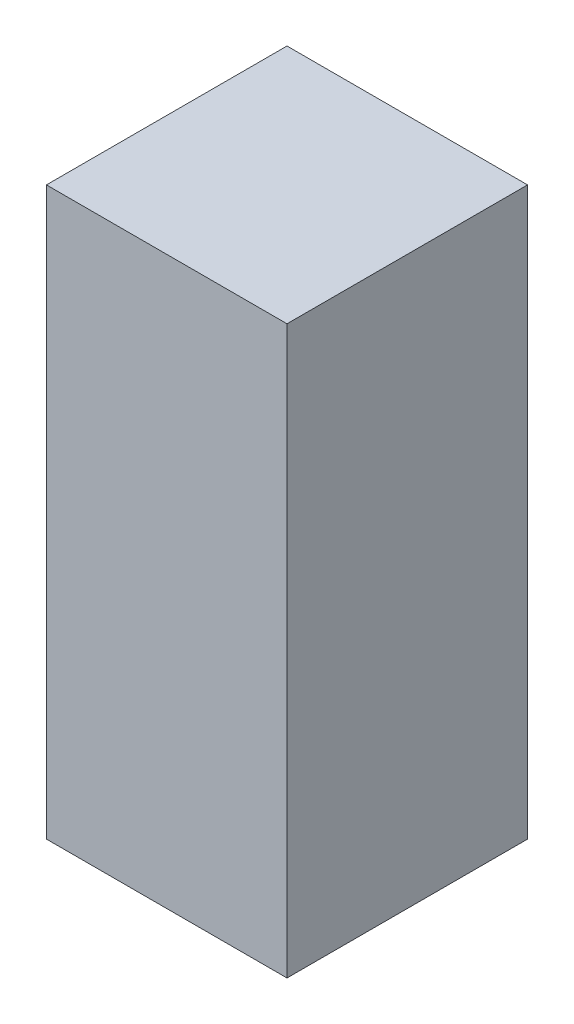
from build123d import *

# Parameters (mm, degrees)
ESQUISSE1_W        = 18.3
ESQUISSE1_H        = 43.1
BOSS_EXTRU_1_DEPTH = 18.3


with BuildPart() as part:
    # Esquisse1 → Boss.-Extru.1 (new body)
    with BuildSketch(Plane.XY):
        Rectangle(ESQUISSE1_W, ESQUISSE1_H)
    extrude(amount=-BOSS_EXTRU_1_DEPTH)


solid = part.part
